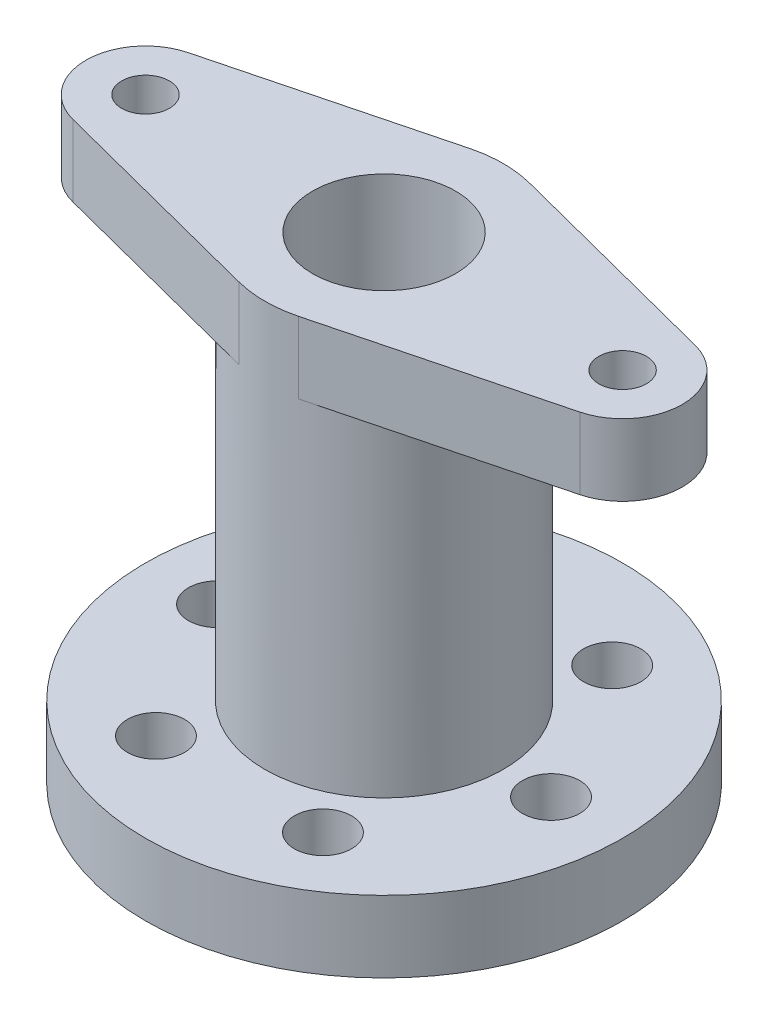
from build123d import *
from build123d.topology import SkipClean

# Parameters (mm, degrees)
SKETCH1_R           = 50
SKETCH1_R_2         = 6
BOSS_EXTRUDE1_DEPTH = 15
SKETCH2_R           = 25
SKETCH2_R_2         = 15
BOSS_EXTRUDE2_DEPTH = 70
BOSS_EXTRUDE3_DEPTH = 15
CUT_EXTRUDE1_START  = -40
SKETCH4_R           = 15
SKETCH4_R_2         = 5
CUT_EXTRUDE1_DEPTH  = 40


with BuildPart() as part:
    # Sketch1 → Boss-Extrude1 (new body)
    with BuildSketch(Plane(origin=(0, 0, 0), x_dir=(1, 0, 0), z_dir=(0, 1, 0))):
        with Locations(Location((0, 0, 0), (0, 0, 270))):
            Circle(SKETCH1_R)
        with Locations(Location((-35, 0, 0), (0, 0, 270))):
            Circle(SKETCH1_R_2, mode=Mode.SUBTRACT)
        with Locations(Location((-17.5, 30.310889132, 0), (0, 0, 270))):
            Circle(SKETCH1_R_2, mode=Mode.SUBTRACT)
        with Locations(Location((17.5, 30.310889132, 0), (0, 0, 270))):
            Circle(SKETCH1_R_2, mode=Mode.SUBTRACT)
        with Locations(Location((35, 0, 0), (0, 0, 270))):
            Circle(SKETCH1_R_2, mode=Mode.SUBTRACT)
        with Locations(Location((17.5, -30.310889132, 0), (0, 0, 270))):
            Circle(SKETCH1_R_2, mode=Mode.SUBTRACT)
        with Locations(Location((-17.5, -30.310889132, 0), (0, 0, 270))):
            Circle(SKETCH1_R_2, mode=Mode.SUBTRACT)
    extrude(amount=BOSS_EXTRUDE1_DEPTH)

    # Sketch2 → Boss-Extrude2 (add)
    with BuildSketch(Plane(origin=(0, 15, 0), x_dir=(1, 0, 0), z_dir=(0, 1, 0))):
        with Locations(Location((0, 0, 0), (0, 0, 270))):
            Circle(SKETCH2_R)
        with Locations(Location((0, 0, 0), (0, 0, 270))):
            Circle(SKETCH2_R_2, mode=Mode.SUBTRACT)
    extrude(amount=BOSS_EXTRUDE2_DEPTH)

    # Sketch3 → Boss-Extrude3 (add)
    with SkipClean():  # the faces are left unmerged after this step: merging them gives an invalid solid
        with BuildSketch(Plane(origin=(0, 85, 0), x_dir=(1, 0, 0), z_dir=(0, 1, 0))):
            with BuildLine():
                Line((-53.125, 12.103072957), (-6.25, 24.206145914))
                ThreePointArc((-6.25, 24.206145914), (0, 25), (6.25, 24.206145914))
                Line((6.25, 24.206145914), (53.125, 12.103072957))
                ThreePointArc((53.125, 12.103072957), (62.5, 0), (53.125, -12.103072957))
                Line((53.125, -12.103072957), (6.25, -24.206145914))
                ThreePointArc((6.25, -24.206145914), (0, -25), (-6.25, -24.206145914))
                Line((-6.25, -24.206145914), (-53.125, -12.103072957))
                ThreePointArc((-53.125, -12.103072957), (-62.5, 0), (-53.125, 12.103072957))
            make_face()
        extrude(amount=BOSS_EXTRUDE3_DEPTH)

    # Sketch4 → Cut-Extrude1 (cut)
    with SkipClean():  # the faces are left unmerged after this step: merging them gives an invalid solid
        with BuildSketch(Plane(origin=(0, 100, 0), x_dir=(1, 0, 0), z_dir=(0, 1, 0)).offset(CUT_EXTRUDE1_START)):
            with Locations(Location((0, 0, 0), (0, 0, 270))):
                Circle(SKETCH4_R)
            with Locations(Location((-50, 0, 0), (0, 0, 270))):
                Circle(SKETCH4_R_2)
            with Locations(Location((50, 0, 0), (0, 0, 270))):
                Circle(SKETCH4_R_2)
        extrude(amount=CUT_EXTRUDE1_DEPTH, mode=Mode.SUBTRACT)


solid = part.part
